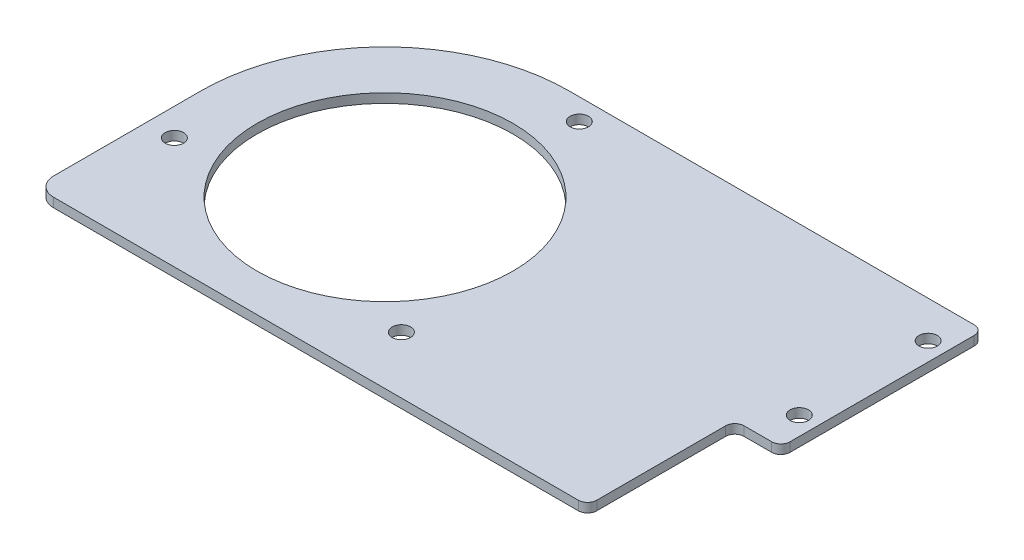
from build123d import *

# Parameters (mm, degrees)
SKETCH1_R           = 88.265
SKETCH1_R_2         = 6.35
BOSS_EXTRUDE1_DEPTH = 6.35


with BuildPart() as part:
    # Sketch1 → Boss-Extrude1 (new body)
    with BuildSketch(Plane(origin=(0, 0, 0), x_dir=(1, 0, 0), z_dir=(0, 1, 0))):
        with BuildLine():
            Line((279.4, 127), (0, 127))
            ThreePointArc((0, 127), (-89.802561211, 89.802561211), (-127, 0))
            Line((-127, 0), (-127, -101.6))
            ThreePointArc((-127, -101.6), (-123.280256121, -110.580256121), (-114.3, -114.3))
            Line((-114.3, -114.3), (247.65, -114.3))
            ThreePointArc((247.65, -114.3), (252.140128061, -112.440128061), (254, -107.95))
            Line((254, -107.95), (254, -19.05))
            ThreePointArc((254, -19.05), (255.859871939, -14.559871939), (260.35, -12.7))
            Line((260.35, -12.7), (279.4, -12.7))
            ThreePointArc((279.4, -12.7), (283.890128061, -10.840128061), (285.75, -6.35))
            Line((285.75, -6.35), (285.75, 120.65))
            ThreePointArc((285.75, 120.65), (283.890128061, 125.140128061), (279.4, 127))
        make_face()
        with Locations(Location((0, 0, 0), (0, 0, 270))):
            Circle(SKETCH1_R, mode=Mode.SUBTRACT)
        with Locations(Location((-108.072773191, -37.212440054, 0), (0, 0, 270))):
            Circle(SKETCH1_R_2, mode=Mode.SUBTRACT)
        with Locations(Location((21.809468172, 112.199987068, 0), (0, 0, 270))):
            Circle(SKETCH1_R_2, mode=Mode.SUBTRACT)
        with Locations(Location((86.263305019, -74.987547014, 0), (0, 0, 270))):
            Circle(SKETCH1_R_2, mode=Mode.SUBTRACT)
        with Locations(Location((273.05, 101.6, 0), (0, 0, 270))):
            Circle(SKETCH1_R_2, mode=Mode.SUBTRACT)
        with Locations(Location((273.05, 12.7, 0), (0, 0, 270))):
            Circle(SKETCH1_R_2, mode=Mode.SUBTRACT)
    extrude(amount=BOSS_EXTRUDE1_DEPTH)


solid = part.part
